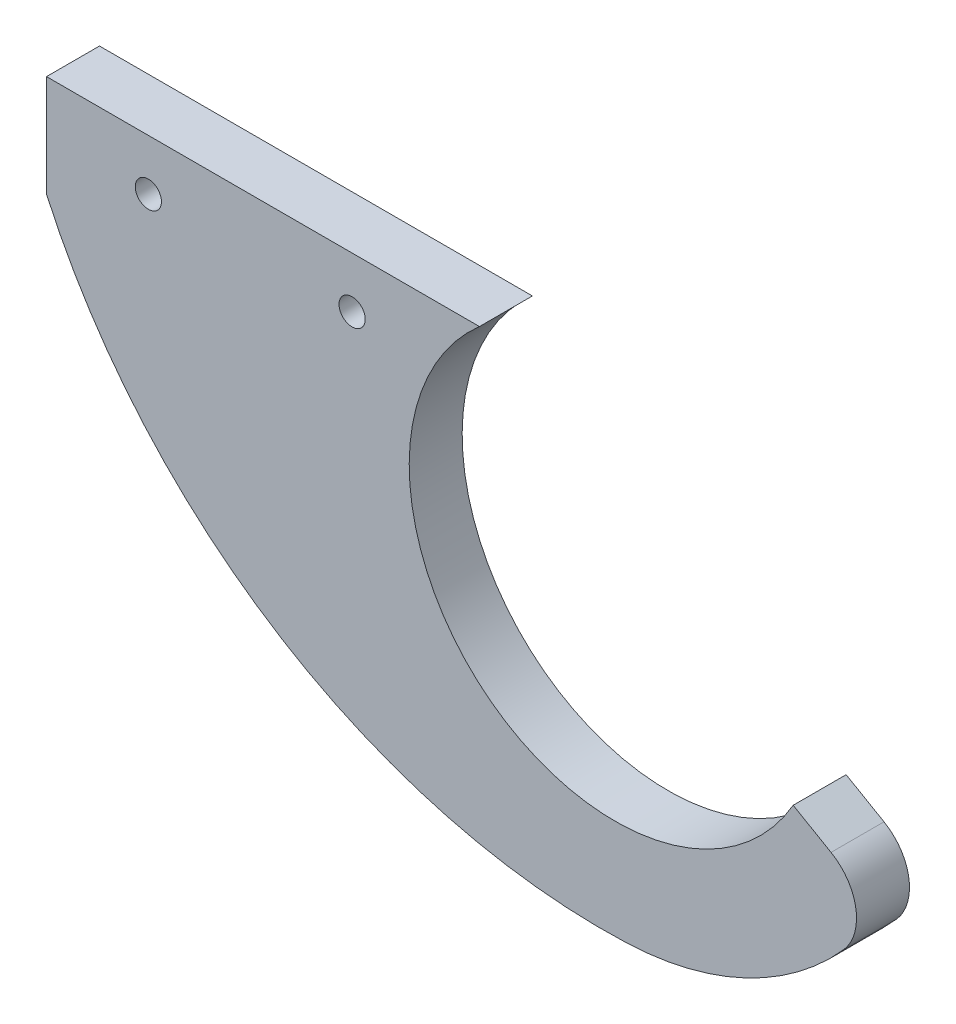
from build123d import *

# Parameters (mm, degrees)
BOSS_EXTRUDE1_DEPTH       = 6.604
FILLET1_R                 = 6.35
F_4_CLEARANCE_HOLE1_D     = 3.2639
F_4_CLEARANCE_HOLE1_DEPTH = 9.652
F_4_CLEARANCE_HOLE1_TIP   = 0.980574487


with BuildPart() as part:
    # Sketch1 → Boss-Extrude1 (new body)
    with BuildSketch(Plane.XY):
        with BuildLine():
            Line((-6.35, -5.08), (-53.975, -5.08))
            Line((-53.975, -5.08), (-53.975, -17.78))
            ThreePointArc((-53.975, -17.78), (-24.613831362, -51.146124163), (18.36841389, -62.455547599))
            ThreePointArc((18.36841389, -62.455547599), (36.58027843, -57.005297746), (49.891818948, -43.434))
            Line((49.891818948, -43.434), (39.113266772, -37.211))
            ThreePointArc((39.113266772, -37.211), (0.611966481, -44.206961223), (0, -5.08))
            Line((0, -5.08), (-6.35, -5.08))
        make_face()
    extrude(amount=BOSS_EXTRUDE1_DEPTH)

    # Fillet1
    fillet1_edges = [part.edges().sort_by_distance(p)[0] for p in [
        (49.891818948, -43.434, 3.302),
    ]]
    fillet(fillet1_edges, radius=FILLET1_R)

    # #4 Clearance Hole1
    with Locations(Plane(origin=(-15.875, -11.43, 6.604), x_dir=(1, 0, 0), z_dir=(0, 0, 1))):
        with Locations((0, 0), (-25.4, 0)):
            Hole(F_4_CLEARANCE_HOLE1_D / 2, depth=F_4_CLEARANCE_HOLE1_DEPTH)
            with Locations((0, 0, -(F_4_CLEARANCE_HOLE1_DEPTH + F_4_CLEARANCE_HOLE1_TIP / 2))):  # 118° drill point
                Cone(0, F_4_CLEARANCE_HOLE1_D / 2, F_4_CLEARANCE_HOLE1_TIP, mode=Mode.SUBTRACT)


solid = part.part
